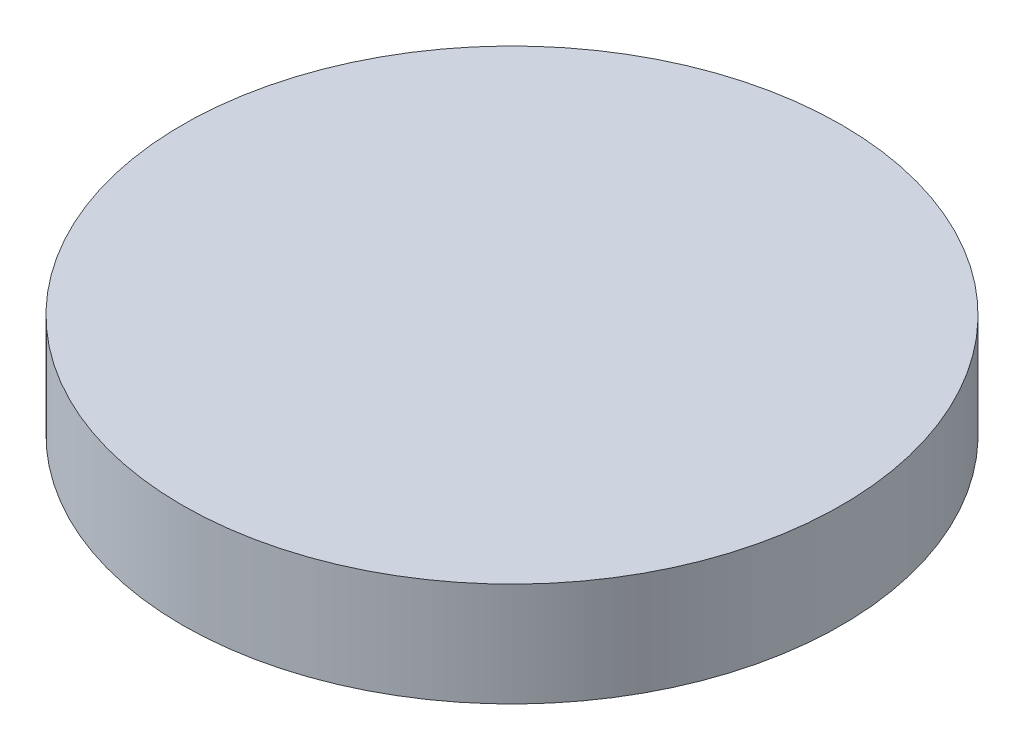
from build123d import *

# Parameters (mm, degrees)
SKETCH1_R           = 6.35
BOSS_EXTRUDE1_DEPTH = 2


with BuildPart() as part:
    # Sketch1 → Boss-Extrude1 (new body)
    with BuildSketch(Plane(origin=(0, 0, 0), x_dir=(1, 0, 0), z_dir=(0, 1, 0))):
        with Locations(Location((0, 0, 0), (0, 0, 270))):
            Circle(SKETCH1_R)
    extrude(amount=BOSS_EXTRUDE1_DEPTH)


solid = part.part
